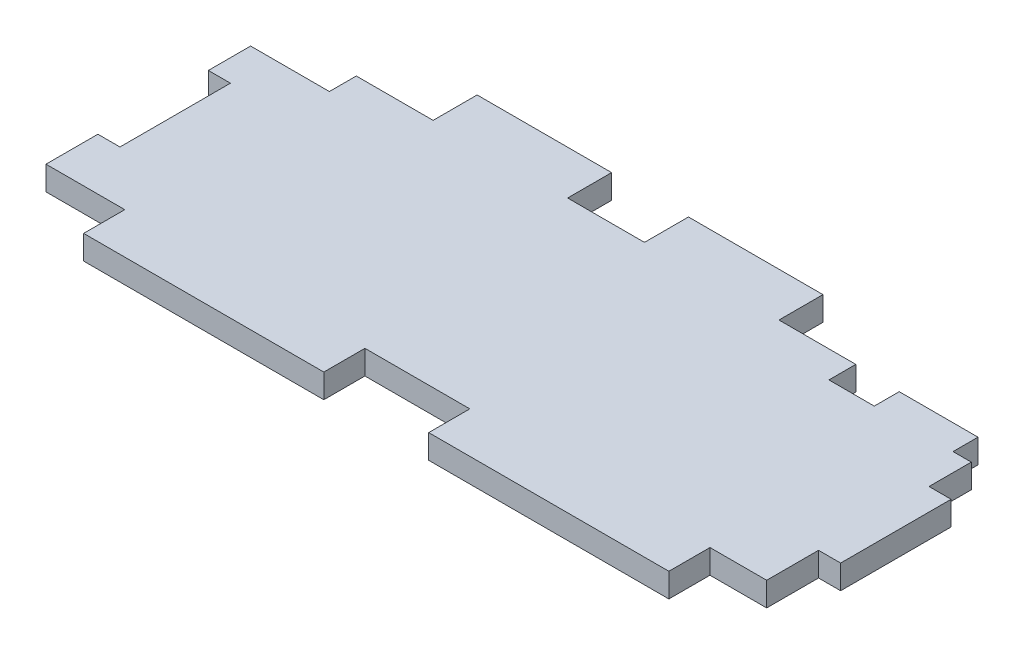
from build123d import *

# Parameters (mm, degrees)
BOSS_EXTRUDE2_DEPTH = 1.5875
SKETCH2_W           = 10.414
SKETCH2_H           = 1.27
SKETCH2_W_2         = 5.9944
SKETCH2_H_2         = 1.016
SKETCH2_W_3         = 2.413
SKETCH2_H_3         = 1.3716
CUT_EXTRUDE1_DEPTH  = 57.702519048
SKETCH3_W           = 10.16
SKETCH3_H           = 0.635
SKETCH3_W_2         = 10.414
CUT_EXTRUDE2_DEPTH  = 57.702519048
SKETCH4_W           = 17.78
SKETCH4_H           = 0.254
CUT_EXTRUDE3_DEPTH  = 57.702519048
SKETCH5_W           = 10.414
SKETCH5_H           = 0.254
CUT_EXTRUDE4_DEPTH  = 57.602133313


with BuildPart() as part:
    # Sketch1 → Boss-Extrude2 (new, symmetric)
    with BuildSketch(Plane(origin=(0, 0, 0), x_dir=(1, 0, 0), z_dir=(0, 1, 0))):
        Polygon((-49.022, -7.3025), (-49.022, 0), (-49.022, 7.3025), (-51.943, 7.3025), (-51.943, 14.1605), (-41.529, 14.1605), (-41.529, 17.0815), (-31.369, 17.0815), (-31.369, 22.5171), (-13.589, 22.5171), (-13.589, 17.0815), (-3.429, 17.0815), (-3.429, 22.5171), (14.351, 22.5171), (14.351, 17.0815), (24.511, 17.0815), (24.511, 13.9065), (30.5054, 13.9065), (30.5054, 17.0815), (40.9194, 17.0815), (40.9194, 14.2621), (43.3324, 14.2621), (43.3324, 7.3025), (46.2534, 7.3025), (46.2534, 0), (46.2534, -7.3025), (43.3324, -7.3025), (43.3324, -14.1605), (35.8394, -14.1605), (35.8394, -19.5961), (4.0894, -19.5961), (4.0894, -14.1605), (-9.779, -14.1605), (-9.779, -19.5961), (-41.529, -19.5961), (-41.529, -14.1605), (-51.943, -14.1605), (-51.943, -7.3025), align=None)
    extrude(amount=BOSS_EXTRUDE2_DEPTH, both=True)

    # Sketch2 → Cut-Extrude1 (cut, through all)
    with BuildSketch(Plane(origin=(0, 1.5875, 0), x_dir=(1, 0, 0), z_dir=(0, 1, 0))):
        with Locations((-46.736, 13.5255)):
            Rectangle(SKETCH2_W, SKETCH2_H)
        with Locations((27.5082, 13.3985)):
            Rectangle(SKETCH2_W_2, SKETCH2_H_2)
        with Locations((42.1259, 13.5763)):
            Rectangle(SKETCH2_W_3, SKETCH2_H_3)
    extrude(amount=-CUT_EXTRUDE1_DEPTH, mode=Mode.SUBTRACT)

    # Sketch3 → Cut-Extrude2 (cut, through all)
    with BuildSketch(Plane(origin=(0, 1.5875, 0), x_dir=(1, 0, 0), z_dir=(0, 1, 0))):
        with Locations((-36.449, 16.764)):
            Rectangle(SKETCH3_W, SKETCH3_H)
        with Locations((-8.509, 16.764)):
            Rectangle(SKETCH3_W, SKETCH3_H)
        with Locations((19.431, 16.764)):
            Rectangle(SKETCH3_W, SKETCH3_H)
        with Locations((35.7124, 16.764)):
            Rectangle(SKETCH3_W_2, SKETCH3_H)
    extrude(amount=-CUT_EXTRUDE2_DEPTH, mode=Mode.SUBTRACT)

    # Sketch4 → Cut-Extrude3 (cut, through all)
    with BuildSketch(Plane(origin=(0, 1.5875, 0), x_dir=(1, 0, 0), z_dir=(0, 1, 0))):
        with Locations((-22.479, 22.3901)):
            Rectangle(SKETCH4_W, SKETCH4_H)
        with Locations((5.461, 22.3901)):
            Rectangle(SKETCH4_W, SKETCH4_H)
    extrude(amount=-CUT_EXTRUDE3_DEPTH, mode=Mode.SUBTRACT)

    # Sketch5 → Cut-Extrude4 (cut, through all)
    with BuildSketch(Plane(origin=(0, 1.5875, 0), x_dir=(1, 0, 0), z_dir=(0, 1, 0))):
        with Locations((35.7124, 16.3195)):
            Rectangle(SKETCH5_W, SKETCH5_H)
    extrude(amount=-CUT_EXTRUDE4_DEPTH, mode=Mode.SUBTRACT)


solid = part.part
